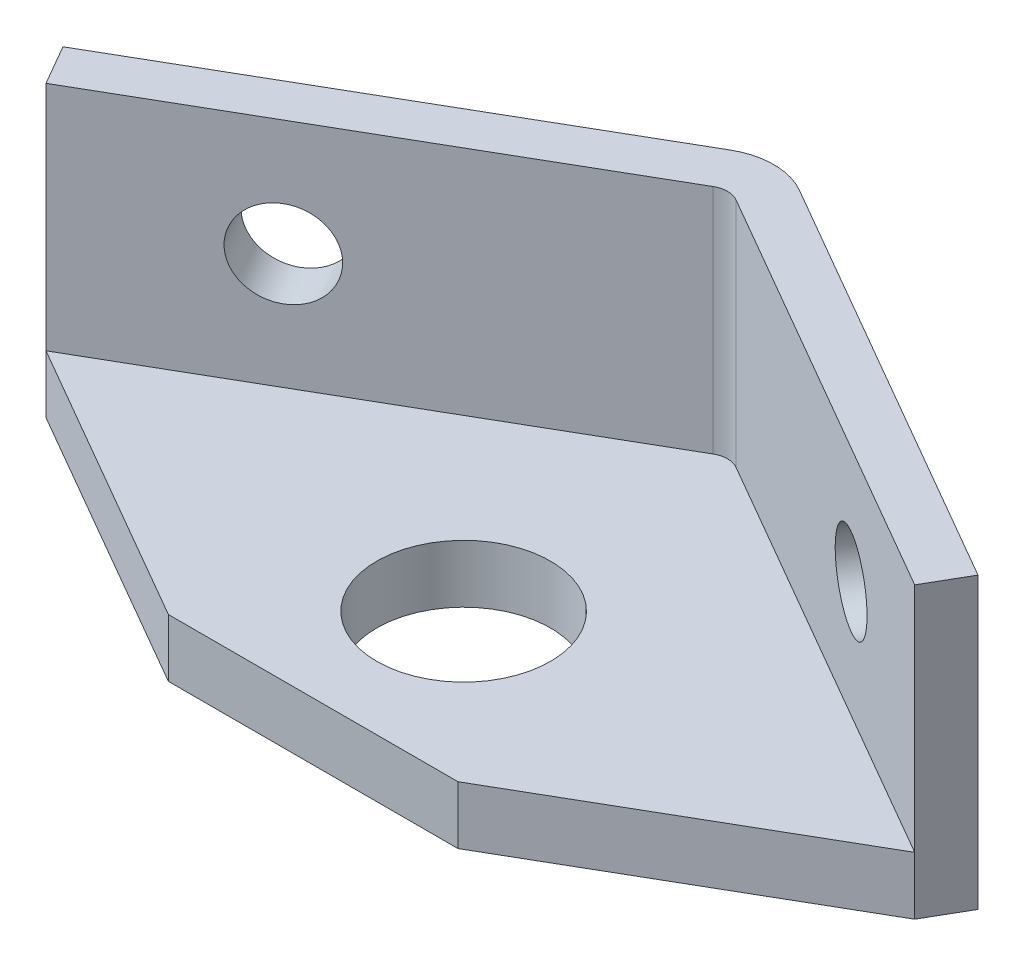
from build123d import *

# Parameters (mm, degrees)
RESSALTO_EXTRUS_O4_DEPTH = 50
ESBO_O1_7_R              = 15
RESSALTO_EXTRUS_O5_DEPTH = 10
CORTE_EXTRUS_O1_REACH    = 128.396
ESBO_O2_R                = 7.5
CORTE_EXTRUS_O2_REACH    = 128.396
ESBO_O3_R                = 7.5


with BuildPart() as part:
    # Esboço1 → Ressalto-extrusão4 (new body)
    with BuildSketch(Plane(origin=(0, 0, 0), x_dir=(1, 0, 0), z_dir=(0, 1, 0))):
        with BuildLine():
            Line((-75, 2.886751346), (-2, 45.033320997))
            ThreePointArc((-2, 45.033320997), (0, 45.569219382), (2, 45.033320997))
            Line((2, 45.033320997), (75, 2.886751346))
            Line((75, 2.886751346), (79, 9.814954576))
            Line((79, 9.814954576), (6, 51.961524227))
            ThreePointArc((6, 51.961524227), (0, 53.569219382), (-6, 51.961524227))
            Line((-6, 51.961524227), (-79, 9.814954576))
            Line((-79, 9.814954576), (-75, 2.886751346))
        make_face()
    extrude(amount=RESSALTO_EXTRUS_O4_DEPTH)

    # Esboço1<7> → Ressalto-extrusão5 (add)
    with BuildSketch(Plane(origin=(0, 0, 0), x_dir=(1, 0, 0), z_dir=(0, 1, 0))):
        with BuildLine():
            ThreePointArc((2, 45.033320997), (0, 45.569219382), (-2, 45.033320997))
            Line((-2, 45.033320997), (-75, 2.886751346))
            Line((-75, 2.886751346), (-25, -25.980762114))
            Line((-25, -25.980762114), (25, -25.980762114))
            Line((25, -25.980762114), (75, 2.886751346))
            Line((75, 2.886751346), (2, 45.033320997))
        make_face()
        Circle(ESBO_O1_7_R, mode=Mode.SUBTRACT)
    extrude(amount=RESSALTO_EXTRUS_O5_DEPTH)

    # Esboço2 → Corte-extrusão1 (cut, up to next)
    with BuildSketch(Plane(origin=(-20, 0, -34.641016151), x_dir=(0.866025403784438, 0, -0.5000000000000012), z_dir=(0.5000000000000011, 0, 0.8660254037844379)), mode=Mode.PRIVATE) as corte_extrus_o1_sk1:
        with Locations((-33.508529611, 30)):
            Circle(ESBO_O2_R)
    corte_extrus_o1_tool1 = extrude(corte_extrus_o1_sk1.sketch, amount=-CORTE_EXTRUS_O1_REACH, mode=Mode.PRIVATE) & part.part
    add(corte_extrus_o1_tool1.solids().sort_by_distance((-49.019238, 30, -17.886751))[0], mode=Mode.SUBTRACT)

    # Esboço3 → Corte-extrusão2 (cut, up to next)
    with BuildSketch(Plane(origin=(20, 0, -34.641016151), x_dir=(0.866025403784438, 0, 0.5000000000000012), z_dir=(-0.5000000000000011, 0, 0.8660254037844379)), mode=Mode.PRIVATE) as corte_extrus_o2_sk1:
        with Locations((33.508529611, 30)):
            Circle(ESBO_O3_R)
    corte_extrus_o2_tool1 = extrude(corte_extrus_o2_sk1.sketch, amount=-CORTE_EXTRUS_O2_REACH, mode=Mode.PRIVATE) & part.part
    add(corte_extrus_o2_tool1.solids().sort_by_distance((49.019238, 30, -17.886751))[0], mode=Mode.SUBTRACT)


solid = part.part
